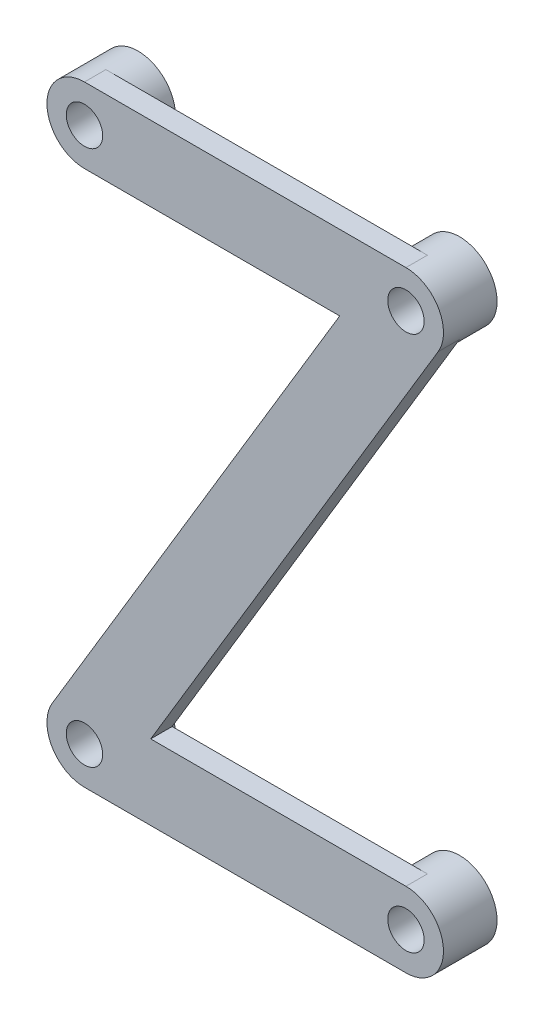
from build123d import *

# Parameters (mm, degrees)
EXTRUDE_944_DEPTH  = 2
SKETCH_1_3_R       = 3.5
SKETCH_1_3_R_2     = 1.7
EXTRUDE_1016_DEPTH = 5


with BuildPart() as part:
    # Эскиз1 → Extrude 944 (new body)
    with BuildSketch(Plane.XY):
        with BuildLine():
            Line((15, 28.5), (-15, 28.5))
            ThreePointArc((-15, 28.5), (-12.525126266, 27.474873734), (-11.5, 25))
            ThreePointArc((-11.5, 25), (-12.525126266, 22.525126266), (-15, 21.5))
            Line((-15, 21.5), (8.818333674, 21.5))
            Line((8.818333674, 21.5), (-18.00122524, -23.199264856))
            ThreePointArc((-18.00122524, -23.199264856), (-14.065732463, -21.626997751), (-11.5, -25))
            ThreePointArc((-11.5, -25), (-12.525126266, -27.474873734), (-15, -28.5))
            Line((-15, -28.5), (15, -28.5))
            ThreePointArc((15, -28.5), (11.5, -25), (15, -21.5))
            Line((15, -21.5), (-8.818333674, -21.5))
            Line((-8.818333674, -21.5), (18.00122524, 23.199264856))
            ThreePointArc((18.00122524, 23.199264856), (11.954300326, 23.275554148), (15, 28.5))
        make_face()
    extrude(amount=-EXTRUDE_944_DEPTH)

    # Эскиз1<3> → Extrude 1016 (add)
    # profile 1 of 4: a face of its own
    with BuildSketch(Plane.XY):
        with Locations((-15, 25)):
            Circle(SKETCH_1_3_R)
        with Locations((-15, 25)):
            Circle(SKETCH_1_3_R_2, mode=Mode.SUBTRACT)
    # profile 2 of 4: a face of its own
    with BuildSketch(Plane.XY):
        with Locations((15, 25)):
            Circle(SKETCH_1_3_R)
        with Locations((15, 25)):
            Circle(SKETCH_1_3_R_2, mode=Mode.SUBTRACT)
    # profile 3 of 4: a face of its own
    with BuildSketch(Plane.XY):
        with Locations((-15, -25)):
            Circle(SKETCH_1_3_R)
        with Locations((-15, -25)):
            Circle(SKETCH_1_3_R_2, mode=Mode.SUBTRACT)
    # profile 4 of 4: a face of its own
    with BuildSketch(Plane.XY):
        with Locations((15, -25)):
            Circle(SKETCH_1_3_R)
        with Locations((15, -25)):
            Circle(SKETCH_1_3_R_2, mode=Mode.SUBTRACT)
    extrude(amount=-EXTRUDE_1016_DEPTH)


solid = part.part
